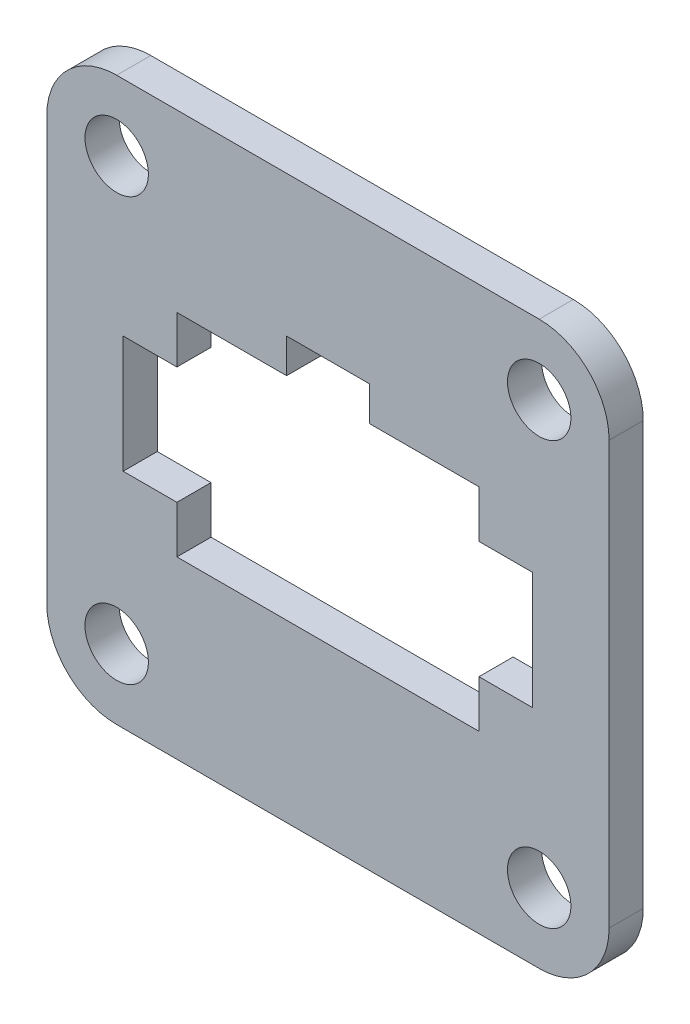
from build123d import *

# Parameters (mm, degrees)
SKETCH1_W           = 26
SKETCH1_H           = 26
BOSS_EXTRUDE1_DEPTH = 1.5875
CUT_EXTRUDE1_DEPTH  = 37.803806274
FILLET1_R           = 3.175
SKETCH5_R           = 1.55
CUT_EXTRUDE2_DEPTH  = 37.803806274
MOVE_FACE1_BY       = 0.0762
MOVE_FACE1_2_BY     = 0.0762
MOVE_FACE1_3_BY     = 0.0762
MOVE_FACE1_4_BY     = 0.0762
MOVE_FACE1_5_BY     = 0.0762
MOVE_FACE1_6_BY     = 0.0762
MOVE_FACE1_7_BY     = 0.0762
MOVE_FACE1_8_BY     = 0.0762
MOVE_FACE1_9_BY     = 0.0762
MOVE_FACE1_10_BY    = 0.0762
MOVE_FACE1_11_BY    = 0.0762
MOVE_FACE1_12_BY    = 0.0762
MOVE_FACE1_13_BY    = 0.0762
MOVE_FACE1_14_BY    = 0.0762
MOVE_FACE1_15_BY    = 0.0762
MOVE_FACE1_16_BY    = 0.0762
MOVE_FACE1_17_BY    = 0.0762
MOVE_FACE1_18_BY    = 0.0762
MOVE_FACE1_19_BY    = 0.0762
MOVE_FACE1_20_BY    = 0.0762
MOVE_FACE1_21_BY    = 0.0762
MOVE_FACE1_22_BY    = 0.0762
MOVE_FACE1_23_BY    = 0.0762
MOVE_FACE1_24_BY    = 0.0762
MOVE_FACE1_25_BY    = 0.0762
MOVE_FACE1_26_BY    = 0.0762
MOVE_FACE1_27_BY    = 0.0762
MOVE_FACE1_28_BY    = 0.0762


with BuildPart() as part:
    # Sketch1 → Boss-Extrude1 (new body)
    with BuildSketch(Plane.XY):
        with Locations((13, 13)):
            Rectangle(SKETCH1_W, SKETCH1_H)
    extrude(amount=BOSS_EXTRUDE1_DEPTH)

    # Sketch2 → Cut-Extrude1 (cut, through all)
    with BuildSketch(Plane.XY.offset(1.5875)):
        Polygon((5.9, 8), (5.9, 10.2), (3.4, 10.2), (3.4, 15.8), (5.9, 15.8), (5.9, 18), (11, 18), (11, 19.6), (15, 19.6), (15, 18), (20.1, 18), (20.1, 15.8), (22.6, 15.8), (22.6, 10.2), (20.1, 10.2), (20.1, 8), align=None)
    extrude(amount=-CUT_EXTRUDE1_DEPTH, mode=Mode.SUBTRACT)

    # Fillet1
    fillet1_edges = [part.edges().sort_by_distance(p)[0] for p in [
        (0, 26, 0.79375),
        (26, 26, 0.79375),
        (26, 0, 0.79375),
        (0, 0, 0.79375),
    ]]
    fillet(fillet1_edges, radius=FILLET1_R)

    # Sketch5 → Cut-Extrude2 (cut, through all)
    with BuildSketch(Plane.XY.offset(1.5875)):
        with Locations((3.175, 22.825)):
            Circle(SKETCH5_R)
        with Locations((22.825, 22.825)):
            Circle(SKETCH5_R)
        with Locations((22.825, 3.175)):
            Circle(SKETCH5_R)
        with Locations((3.175, 3.175)):
            Circle(SKETCH5_R)
    extrude(amount=-CUT_EXTRUDE2_DEPTH, mode=Mode.SUBTRACT)

    # Move Face1: a curved face moved outward by 0.0762
    add(Solid.thicken(part.faces().sort_by_distance((25.07006403, 0.92993597, 0.79375))[0], MOVE_FACE1_BY))

    # Move Face1 2: a face moved outward by 0.0762
    extrude(part.faces().sort_by_distance((26, 13, 0.79375))[0], amount=MOVE_FACE1_2_BY, dir=(1, 0, 0))

    # Move Face1 3: a face moved outward by 0.0762
    extrude(part.faces().sort_by_distance((13, 26, 0.79375))[0], amount=MOVE_FACE1_3_BY, dir=(0, 1, 0))

    # Move Face1 4: a curved face moved outward by 0.0762
    add(Solid.thicken(part.faces().sort_by_distance((25.07006403, 25.07006403, 0.79375))[0], MOVE_FACE1_4_BY))

    # Move Face1 5: a curved face moved outward by 0.0762
    add(Solid.thicken(part.faces().sort_by_distance((0.92993597, 25.07006403, 0.79375))[0], MOVE_FACE1_5_BY))

    # Move Face1 6: a face moved outward by 0.0762
    extrude(part.faces().sort_by_distance((0, 13, 0.79375))[0], amount=MOVE_FACE1_6_BY, dir=(-1, 0, 0))

    # Move Face1 7: a face moved outward by 0.0762
    extrude(part.faces().sort_by_distance((13, 0, 0.79375))[0], amount=MOVE_FACE1_7_BY, dir=(0, -1, 0))

    # Move Face1 8: a curved face moved outward by 0.0762
    add(Solid.thicken(part.faces().sort_by_distance((0.92993597, 0.92993597, 0.79375))[0], MOVE_FACE1_8_BY))

    # Move Face1 9: a curved face moved outward by 0.0762
    add(Solid.thicken(part.faces().sort_by_distance((1.625, 3.175, 0.79375))[0], MOVE_FACE1_9_BY))

    # Move Face1 10: a curved face moved outward by 0.0762
    add(Solid.thicken(part.faces().sort_by_distance((1.625, 22.825, 0.79375))[0], MOVE_FACE1_10_BY))

    # Move Face1 11: a curved face moved outward by 0.0762
    add(Solid.thicken(part.faces().sort_by_distance((21.275, 22.825, 0.79375))[0], MOVE_FACE1_11_BY))

    # Move Face1 12: a curved face moved outward by 0.0762
    add(Solid.thicken(part.faces().sort_by_distance((21.275, 3.175, 0.79375))[0], MOVE_FACE1_12_BY))

    # Move Face1 13: a face moved outward by 0.0762
    extrude(part.faces().sort_by_distance((21.35, 10.2, 0.79375))[0], amount=MOVE_FACE1_13_BY, dir=(0, 1, 0))

    # Move Face1 14: a face moved outward by 0.0762
    extrude(part.faces().sort_by_distance((4.65, 10.2, 0.79375))[0], amount=MOVE_FACE1_14_BY, dir=(0, 1, 0))

    # Move Face1 15: a face moved outward by 0.0762
    extrude(part.faces().sort_by_distance((5.9, 9.1, 0.79375))[0], amount=MOVE_FACE1_15_BY, dir=(1, 0, 0))

    # Move Face1 16: a face moved outward by 0.0762
    extrude(part.faces().sort_by_distance((3.4, 13, 0.79375))[0], amount=MOVE_FACE1_16_BY, dir=(1, 0, 0))

    # Move Face1 17: a face moved outward by 0.0762
    extrude(part.faces().sort_by_distance((5.9, 16.9, 0.79375))[0], amount=MOVE_FACE1_17_BY, dir=(1, 0, 0))

    # Move Face1 18: a face moved outward by 0.0762
    extrude(part.faces().sort_by_distance((11, 18.8, 0.79375))[0], amount=MOVE_FACE1_18_BY, dir=(1, 0, 0))

    # Move Face1 19: a face moved outward by 0.0762
    extrude(part.faces().sort_by_distance((13, 8, 0.79375))[0], amount=MOVE_FACE1_19_BY, dir=(0, 1, 0))

    # Move Face1 20: a face moved outward by 0.0762
    extrude(part.faces().sort_by_distance((20.1, 9.1, 0.79375))[0], amount=MOVE_FACE1_20_BY, dir=(-1, 0, 0))

    # Move Face1 21: a face moved outward by 0.0762
    extrude(part.faces().sort_by_distance((22.6, 13, 0.79375))[0], amount=MOVE_FACE1_21_BY, dir=(-1, 0, 0))

    # Move Face1 22: a face moved outward by 0.0762
    extrude(part.faces().sort_by_distance((20.1, 16.9, 0.79375))[0], amount=MOVE_FACE1_22_BY, dir=(-1, 0, 0))

    # Move Face1 23: a face moved outward by 0.0762
    extrude(part.faces().sort_by_distance((15, 18.8, 0.79375))[0], amount=MOVE_FACE1_23_BY, dir=(-1, 0, 0))

    # Move Face1 24: a face moved outward by 0.0762
    extrude(part.faces().sort_by_distance((13, 19.6, 0.79375))[0], amount=MOVE_FACE1_24_BY, dir=(0, -1, 0))

    # Move Face1 25: a face moved outward by 0.0762
    extrude(part.faces().sort_by_distance((4.65, 15.8, 0.79375))[0], amount=MOVE_FACE1_25_BY, dir=(0, -1, 0))

    # Move Face1 26: a face moved outward by 0.0762
    extrude(part.faces().sort_by_distance((8.45, 18, 0.79375))[0], amount=MOVE_FACE1_26_BY, dir=(0, -1, 0))

    # Move Face1 27: a face moved outward by 0.0762
    extrude(part.faces().sort_by_distance((17.55, 18, 0.79375))[0], amount=MOVE_FACE1_27_BY, dir=(0, -1, 0))

    # Move Face1 28: a face moved outward by 0.0762
    extrude(part.faces().sort_by_distance((21.35, 15.8, 0.79375))[0], amount=MOVE_FACE1_28_BY, dir=(0, -1, 0))


solid = part.part
